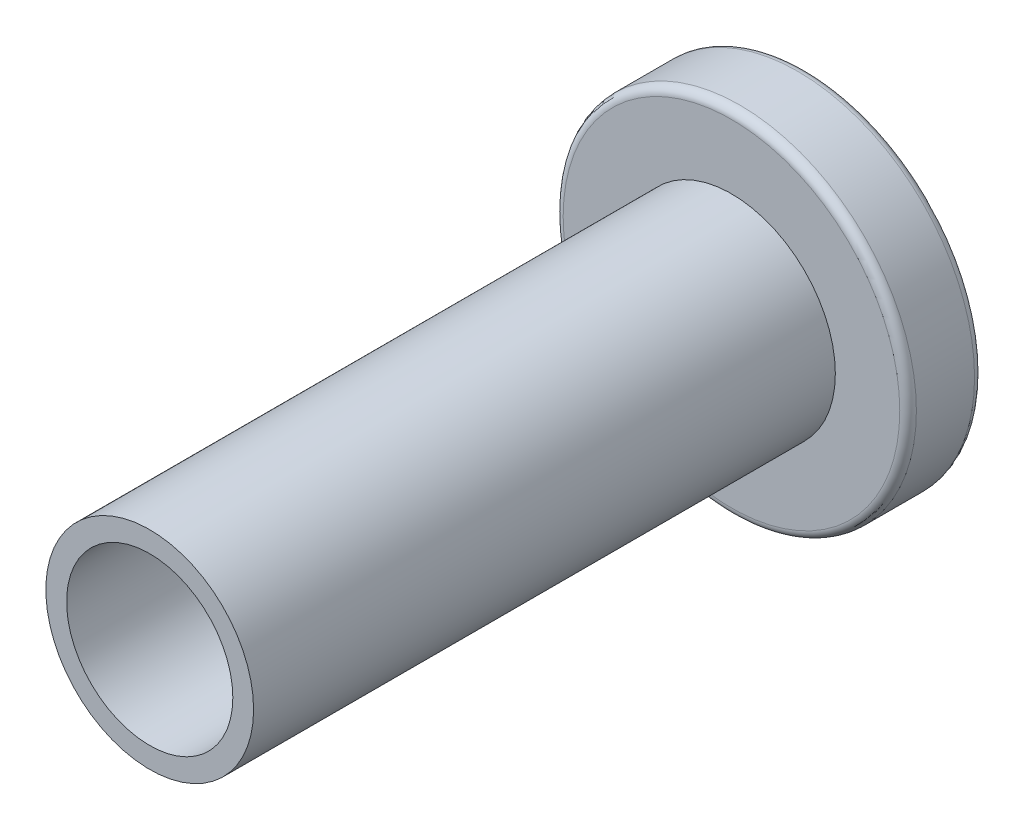
from build123d import *

# Parameters (mm, degrees)
SKETCH_1_R          = 4.25
EXTRUDE_1_DEPTH     = 1.8
SKETCH_2_R          = 2.5
SKETCH_2_R_2        = 2
EXTRUDE_2_DEPTH     = 14
FILLET_1_R          = 0.2
CUT_EXTRUDE_1_DEPTH = 1.5


with BuildPart() as part:
    # 草图1 → 凸台-拉伸1 (new body)
    with BuildSketch(Plane.XY):
        Circle(SKETCH_1_R)
    extrude(amount=EXTRUDE_1_DEPTH)

    # 草图2 → 凸台-拉伸2 (add)
    with BuildSketch(Plane.XY.offset(1.8)):
        Circle(SKETCH_2_R)
        Circle(SKETCH_2_R_2, mode=Mode.SUBTRACT)
    extrude(amount=EXTRUDE_2_DEPTH)

    # 圆角1
    fillet_1_edges = [part.edges().sort_by_distance(p)[0] for p in [
        (-4.25, 0, 0),
        (-4.25, 0, 1.8),
    ]]
    fillet(fillet_1_edges, radius=FILLET_1_R)

    # 草图3 → 切除-拉伸1 (cut)
    with BuildSketch(Plane(origin=(0, 0, 0), x_dir=(-1, 0, 0), z_dir=(0, 0, -1))):
        Polygon((1.443375673, 0), (0.721687836, 1.25), (-0.721687836, 1.25), (-1.443375673, 0), (-0.721687836, -1.25), (0.721687836, -1.25), align=None)
    extrude(amount=-CUT_EXTRUDE_1_DEPTH, mode=Mode.SUBTRACT)


solid = part.part
